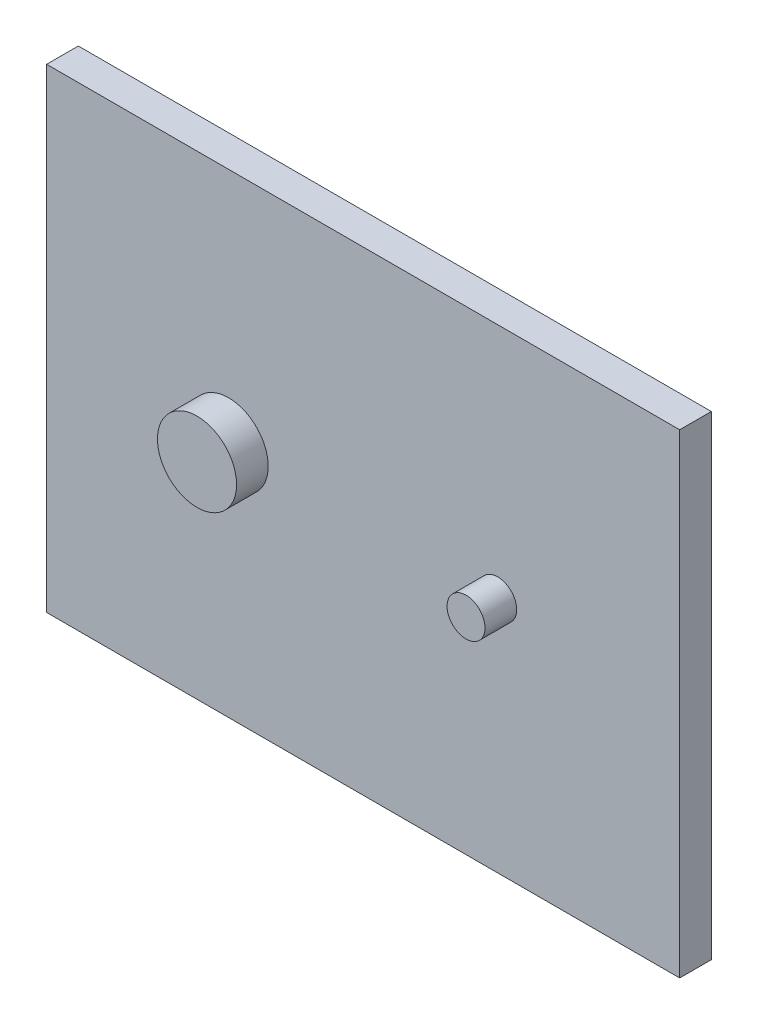
from build123d import *

# Parameters (mm, degrees)
SKETCH1_W      = 200
SKETCH1_H      = 150
EXTRUDE1_DEPTH = 10
SKETCH2_R      = 12.5
SKETCH2_R_2    = 6
EXTRUDE2_DEPTH = 10


with BuildPart() as part:
    # Sketch1 → Extrude1 (new body)
    with BuildSketch(Plane.XY):
        with Locations((-27.921269036, -31.272030457)):
            Rectangle(SKETCH1_W, SKETCH1_H)
    extrude(amount=EXTRUDE1_DEPTH)

    # Sketch2 → Extrude2 (add)
    with BuildSketch(Plane.XY.offset(10)):
        with Locations((-70.421269036, -31.272030457)):
            Circle(SKETCH2_R)
        with Locations((14.578730964, -31.272030457)):
            Circle(SKETCH2_R_2)
    extrude(amount=EXTRUDE2_DEPTH)


solid = part.part
